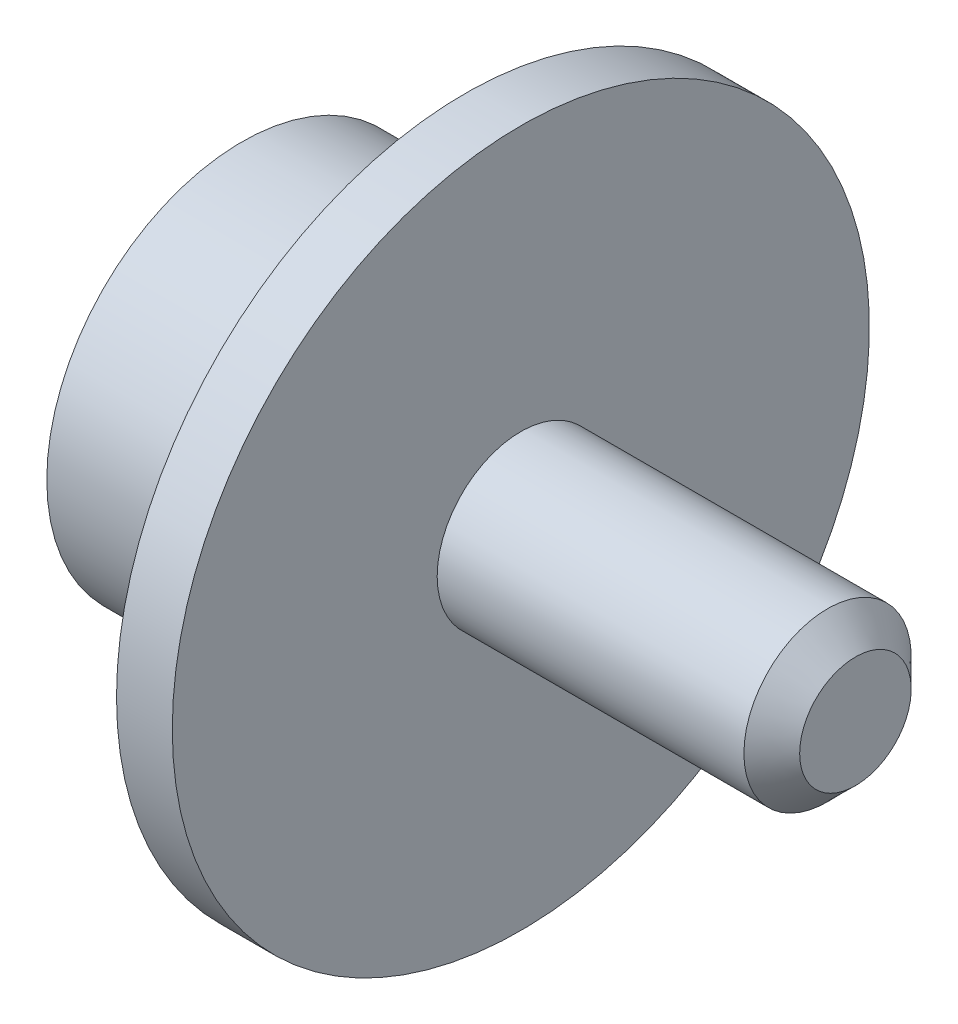
from build123d import *

# Parameters (mm, degrees)
CHAMFER1_SIZE = 1


with BuildPart() as part:
    # Sketch2 → Revolve1 (revolve)
    with BuildSketch(Plane.XY, mode=Mode.PRIVATE) as revolve1_sk:
        Polygon((7, 0), (7, 5.5), (0, 5.5), (0, 7), (8, 7), (8, 12.5), (10, 12.5), (10, 3), (22, 3), (22, 0), align=None)
    revolve(revolve1_sk.sketch.rotate(Axis((0, 0, 0), (1, 0, 0)), 90), axis=Axis((0, 0, 0), (1, 0, 0)))

    # Chamfer1
    chamfer1_edges = [part.edges().sort_by_distance(p)[0] for p in [
        (22, 0, -3),
    ]]
    chamfer(chamfer1_edges, length=CHAMFER1_SIZE)


solid = part.part
